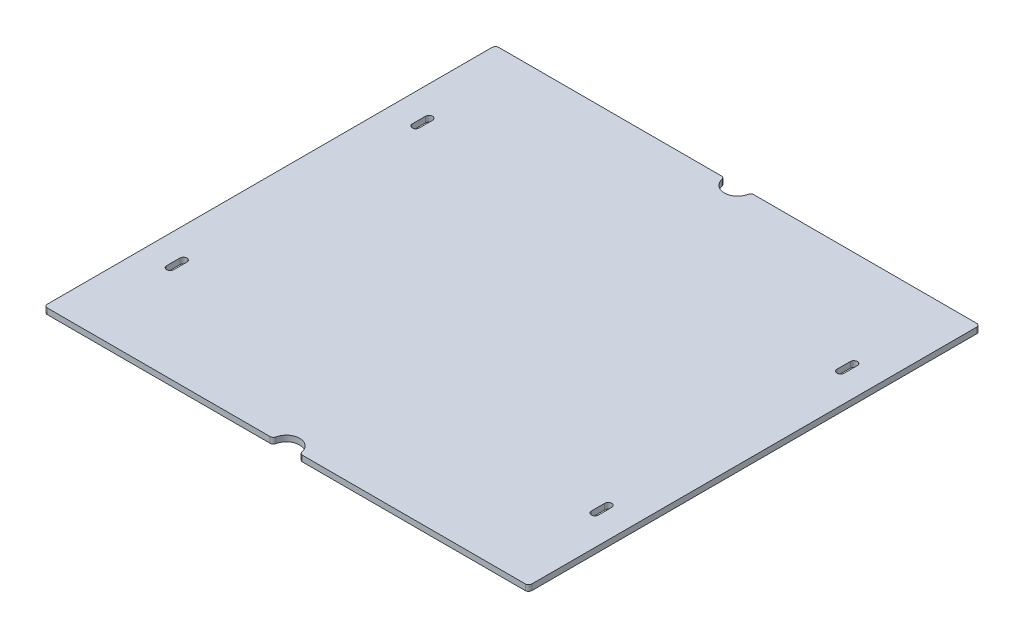
from build123d import *

# Parameters (mm, degrees)
SKETCH1_W           = 463.55
SKETCH1_H           = 431.8
BOSS_EXTRUDE1_DEPTH = 5.588
FILLET1_R           = 3.175
SKETCH2_R           = 12.7
CUT_EXTRUDE1_DEPTH  = 634.530637179
FILLET2_R           = 3.175


with BuildPart() as part:
    # Sketch1 → Boss-Extrude1 (new body)
    with BuildSketch(Plane(origin=(0, 0, 0), x_dir=(1, 0, 0), z_dir=(0, 1, 0))):
        with Locations((231.775, 215.9)):
            Rectangle(SKETCH1_W, SKETCH1_H)
        with BuildLine():
            Line((31.9532, 339.725), (31.9532, 327.025))
            ThreePointArc((31.9532, 327.025), (28.575, 323.6468), (25.1968, 327.025))
            Line((25.1968, 327.025), (25.1968, 339.725))
            ThreePointArc((25.1968, 339.725), (28.575, 343.1032), (31.9532, 339.725))
        make_face(mode=Mode.SUBTRACT)
        with BuildLine():
            Line((31.9532, 92.075), (31.9532, 104.775))
            ThreePointArc((31.9532, 104.775), (28.575, 108.1532), (25.1968, 104.775))
            Line((25.1968, 104.775), (25.1968, 92.075))
            ThreePointArc((25.1968, 92.075), (28.575, 88.6968), (31.9532, 92.075))
        make_face(mode=Mode.SUBTRACT)
        with BuildLine():
            Line((431.5968, 92.075), (431.5968, 104.775))
            ThreePointArc((431.5968, 104.775), (434.975, 108.1532), (438.3532, 104.775))
            Line((438.3532, 104.775), (438.3532, 92.075))
            ThreePointArc((438.3532, 92.075), (434.975, 88.6968), (431.5968, 92.075))
        make_face(mode=Mode.SUBTRACT)
        with BuildLine():
            Line((431.5968, 339.725), (431.5968, 327.025))
            ThreePointArc((431.5968, 327.025), (434.975, 323.6468), (438.3532, 327.025))
            Line((438.3532, 327.025), (438.3532, 339.725))
            ThreePointArc((438.3532, 339.725), (434.975, 343.1032), (431.5968, 339.725))
        make_face(mode=Mode.SUBTRACT)
    extrude(amount=BOSS_EXTRUDE1_DEPTH)

    # Fillet1
    fillet1_edges = [part.edges().sort_by_distance(p)[0] for p in [
        (0, 2.794, -431.8),
        (463.55, 2.794, -431.8),
        (463.55, 2.794, 0),
        (0, 2.794, 0),
    ]]
    fillet(fillet1_edges, radius=FILLET1_R)

    # Sketch2 → Cut-Extrude1 (cut, through all)
    with BuildSketch(Plane(origin=(0, 5.588, 0), x_dir=(1, 0, 0), z_dir=(0, 1, 0))):
        with Locations((231.775, 431.8)):
            Circle(SKETCH2_R)
        with Locations((231.775, 0)):
            Circle(SKETCH2_R)
    extrude(amount=-CUT_EXTRUDE1_DEPTH, mode=Mode.SUBTRACT)

    # Fillet2
    fillet2_edges = [part.edges().sort_by_distance(p)[0] for p in [
        (244.475, 2.794, 0),
        (219.075, 2.794, 0),
        (219.075, 2.794, -431.8),
        (244.475, 2.794, -431.8),
    ]]
    fillet(fillet2_edges, radius=FILLET2_R)


solid = part.part
